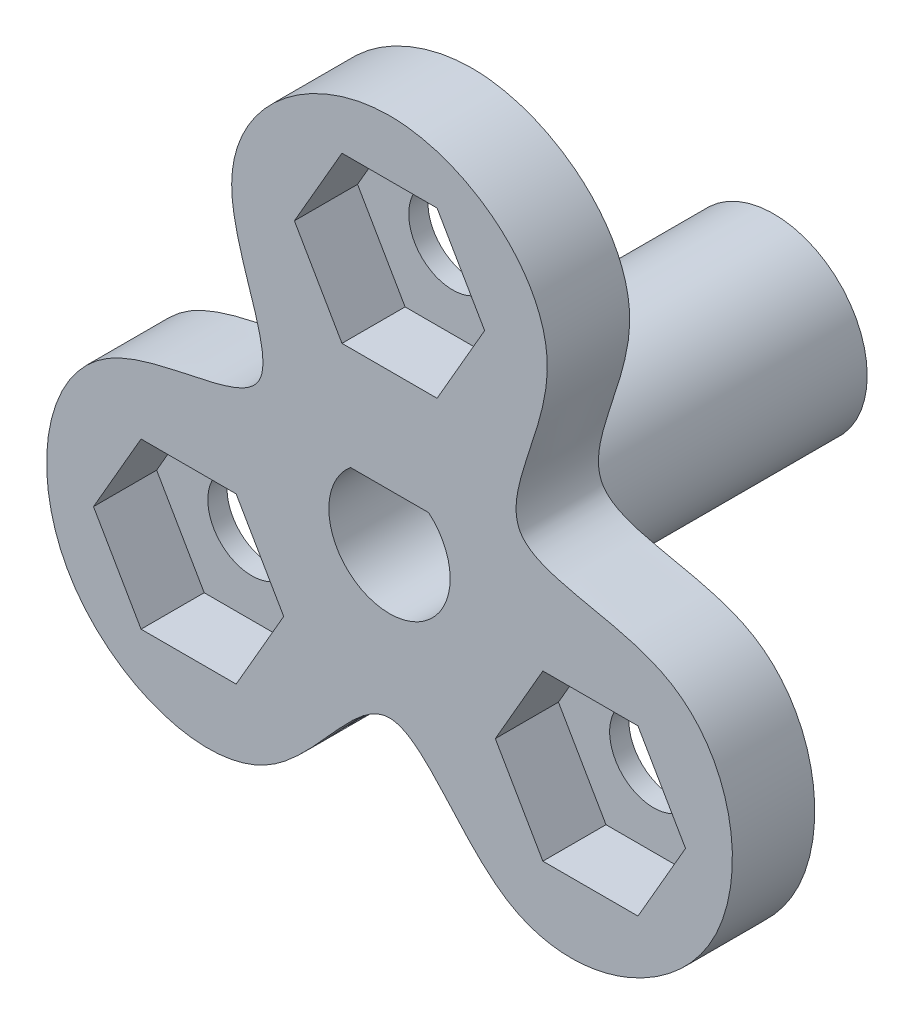
from build123d import *

# Parameters (mm, degrees)
SKETCH1_R                = 3.4
BOSS_EXTRUDE1_DEPTH      = 3
SKETCH1_3_R              = 1.6
BOSS_EXTRUDE2_DEPTH      = 0.7
BOSS_EXTRUDE2_2_DEPTH    = 0.7
BOSS_EXTRUDE2_3_DEPTH    = 0.7
BOSS_EXTRUDE3_DEPTH      = 3
BOSS_EXTRUDE3_DEPTH_BACK = 11
SKETCH1_4_R              = 3.4


with BuildPart() as part:
    # Sketch1 → Boss-Extrude1 (new body)
    with BuildSketch(Plane.XY):
        with BuildLine():
            add(Edge.make_bspline(
                [(0, 13.5), (-2.87331986, 13.5), (-7.91873378, 9.565764361), (-2.473691529, 1.42818647), (-12.243561833, 2.074942439), (-13.631684456, -7.87025669), (-4.324828053, -11.6407068), (0, -2.856372941), (4.324828053, -11.6407068), (13.631684456, -7.87025669), (12.243561833, 2.074942439), (2.473691529, 1.42818647), (7.91873378, 9.565764361), (2.87331986, 13.5), (0, 13.5)],
                knots=[0, 0, 0, 0, 0.094915234, 0.166666667, 0.238418099, 0.333333333, 0.428248567, 0.5, 0.571751433, 0.666666667, 0.761581901, 0.833333333, 0.905084766, 1, 1, 1, 1], degree=3))
        make_face()
        Polygon((-3.853813047, -4.225), (-5.585863854, -7.225), (-9.04996547, -7.225), (-10.782016277, -4.225), (-9.04996547, -1.225), (-5.585863854, -1.225), align=None, mode=Mode.SUBTRACT)
        Circle(SKETCH1_R, mode=Mode.SUBTRACT)
        Polygon((5.585863854, -1.225), (9.04996547, -1.225), (10.782016277, -4.225), (9.04996547, -7.225), (5.585863854, -7.225), (3.853813047, -4.225), align=None, mode=Mode.SUBTRACT)
        Polygon((-1.732050808, 5.45), (-3.464101615, 8.45), (-1.732050808, 11.45), (1.732050808, 11.45), (3.464101615, 8.45), (1.732050808, 5.45), align=None, mode=Mode.SUBTRACT)
    extrude(amount=BOSS_EXTRUDE1_DEPTH)

    # Sketch1<4> → Boss-Extrude3 (add, two sides: drawn at the far end of the back side and taken through both)
    with BuildSketch(Plane.XY.offset(-BOSS_EXTRUDE3_DEPTH_BACK)):
        Circle(SKETCH1_4_R)
        with BuildLine():
            ThreePointArc((1.42407865, 1.69), (0, -2.21), (-1.42407865, 1.69))
            Line((-1.42407865, 1.69), (1.42407865, 1.69))
        make_face(mode=Mode.SUBTRACT)
    extrude(amount=BOSS_EXTRUDE3_DEPTH + BOSS_EXTRUDE3_DEPTH_BACK)


with BuildPart() as body_2:
    # Sketch1<3> → Boss-Extrude2 (new body)
    with BuildSketch(Plane.XY):
        Polygon((-1.732050808, 11.45), (-3.464101615, 8.45), (-1.732050808, 5.45), (1.732050808, 5.45), (3.464101615, 8.45), (1.732050808, 11.45), align=None)
        with Locations((0, 8.45)):
            Circle(SKETCH1_3_R, mode=Mode.SUBTRACT)
    extrude(amount=BOSS_EXTRUDE2_DEPTH)


with BuildPart() as body_3:
    # Sketch1<3> → Boss-Extrude2 2 (new body)
    with BuildSketch(Plane.XY):
        Polygon((10.782016277, -4.225), (9.04996547, -1.225), (5.585863854, -1.225), (3.853813047, -4.225), (5.585863854, -7.225), (9.04996547, -7.225), align=None)
        with Locations((7.317914662, -4.225)):
            Circle(SKETCH1_3_R, mode=Mode.SUBTRACT)
    extrude(amount=BOSS_EXTRUDE2_2_DEPTH)


with BuildPart() as body_4:
    # Sketch1<3> → Boss-Extrude2 3 (new body)
    with BuildSketch(Plane.XY):
        Polygon((-9.04996547, -7.225), (-5.585863854, -7.225), (-3.853813047, -4.225), (-5.585863854, -1.225), (-9.04996547, -1.225), (-10.782016277, -4.225), align=None)
        with Locations((-7.317914662, -4.225)):
            Circle(SKETCH1_3_R, mode=Mode.SUBTRACT)
    extrude(amount=BOSS_EXTRUDE2_3_DEPTH)

    # Combine1: union body 2, body 3, part
    add(body_2.part)
    add(body_3.part)
    add(part.part)


solid = body_4.part
